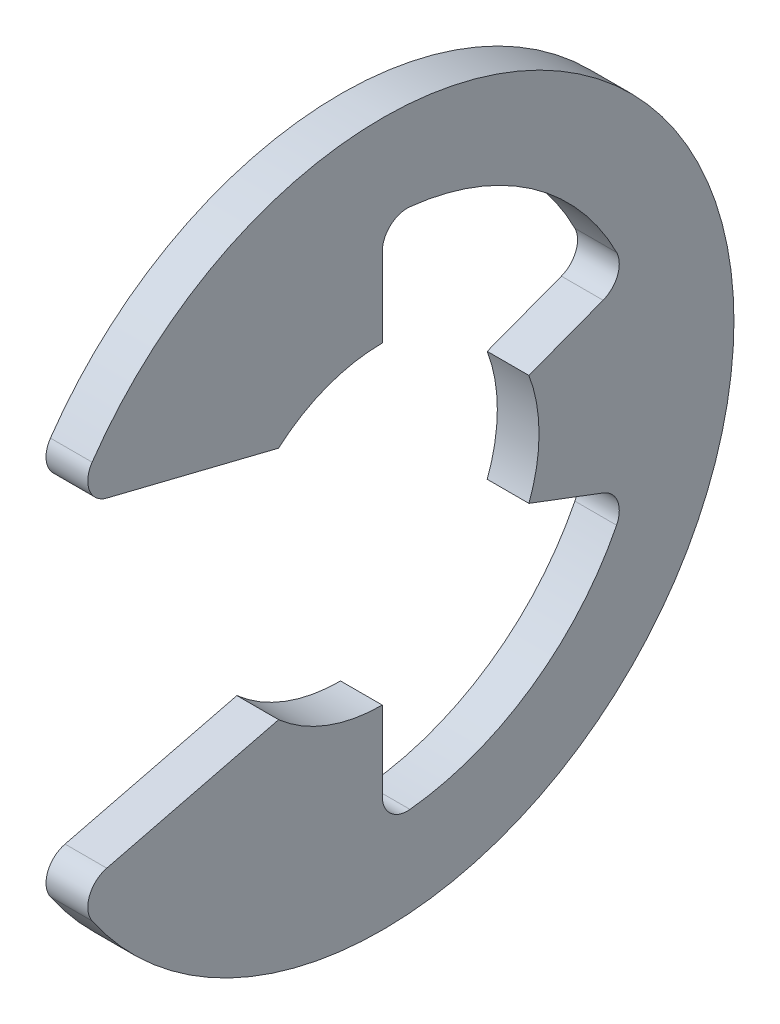
from build123d import *

# Parameters (mm, degrees)
EXTRUDE1_DEPTH = 0.35
FILLET1_R      = 0.42


with BuildPart() as part:
    # Sketch1 → Extrude1 (new, symmetric)
    with BuildSketch(Plane(origin=(0, 0, 0), x_dir=(0, 0, -1), z_dir=(1, 0, 0))):
        with BuildLine():
            Line((-5.178952745, -2.826384345), (-1.739581487, -1.9725))
            ThreePointArc((-1.739581487, -1.9725), (-0.929845417, -2.460139732), (0, -2.63))
            Line((0, -2.63), (0, -4.402580645))
            ThreePointArc((0, -4.402580645), (2.502987341, -3.621846312), (4.118237098, -1.556547314))
            Line((4.118237098, -1.556547314), (2.460139732, -0.929845417))
            ThreePointArc((2.460139732, -0.929845417), (2.63, 0), (2.460139732, 0.929845417))
            Line((2.460139732, 0.929845417), (4.118237098, 1.556547314))
            ThreePointArc((4.118237098, 1.556547314), (2.502987341, 3.621846312), (0, 4.402580645))
            Line((0, 4.402580645), (0, 2.63))
            ThreePointArc((0, 2.63), (-0.929845417, 2.460139732), (-1.739581487, 1.9725))
            Line((-1.739581487, 1.9725), (-5.178952745, 2.826384345))
            ThreePointArc((-5.178952745, 2.826384345), (5.9, 0), (-5.178952745, -2.826384345))
        make_face()
    extrude(amount=EXTRUDE1_DEPTH, both=True)

    # Fillet1
    fillet1_edges = [part.edges().sort_by_distance(p)[0] for p in [
        (0, -2.826384345, 5.178952745),
        (0, -4.402580645, 0),
        (0, -1.556547314, -4.118237098),
        (0, 1.556547314, -4.118237098),
        (0, 4.402580645, 0),
        (0, 2.826384345, 5.178952745),
    ]]
    fillet(fillet1_edges, radius=FILLET1_R)


solid = part.part
